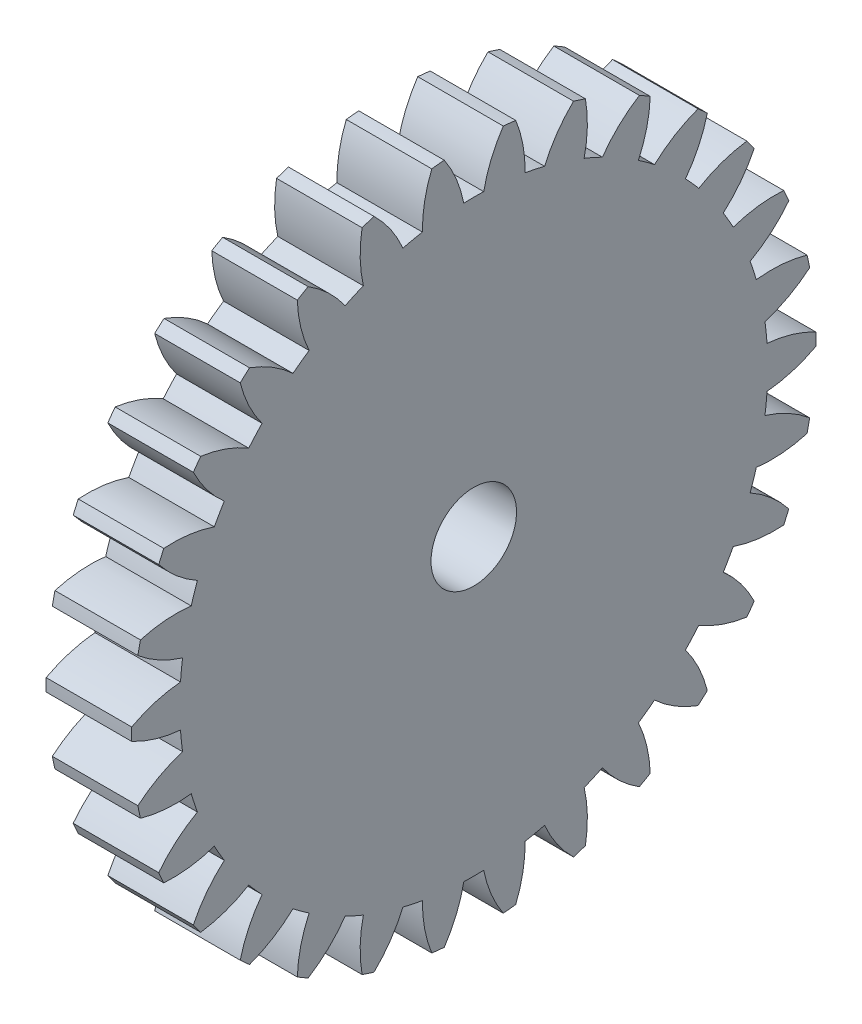
from build123d import *

# Parameters (mm, degrees)
BASPROSKE_W     = 4
BASPROSKE_H     = 16
TOOTHCUT_DEPTH  = 23.978250586
TEETHCUTS_COUNT = 30
TEETHCUTS_ANGLE = 348
BORSKE_R        = 2
BORE_DEPTH      = 50.0000508


with BuildPart() as part:
    # BasProSke → Base-Revolve (revolve)
    with BuildSketch(Plane(origin=(0, 0, 0), x_dir=(1, 0, 0), z_dir=(0, 1, 0)), mode=Mode.PRIVATE) as base_revolve_sk:
        with Locations((2, 8)):
            Rectangle(BASPROSKE_W, BASPROSKE_H)
    revolve(base_revolve_sk.sketch.rotate(Axis((-10, 0, 0), (1, 0, 0)), 180), axis=Axis((-10, 0, 0), (1, 0, 0)))

    # TooCutSke → ToothCut (cut, through all)
    with BuildSketch(Plane(origin=(0, 0, 0), x_dir=(0, 0, -1), z_dir=(1, 0, 0))):
        with BuildLine():
            ThreePointArc((0.466400716, 13.741086979), (0, 13.749), (-0.466400716, 13.741086979))
            ThreePointArc((-0.466400716, 13.741086979), (-0.819142092, 14.899954875), (-1.3974676, 15.964351834))
            ThreePointArc((-1.3974676, 15.964351834), (0, 16.0254), (1.3974676, 15.964351834))
            ThreePointArc((1.3974676, 15.964351834), (0.819142092, 14.899954875), (0.466400716, 13.741086979))
        make_face()
    toothcut = extrude(amount=TOOTHCUT_DEPTH, mode=Mode.SUBTRACT)

    # TeethCuts: ToothCut ×30 about axis
    teethcuts_axis = Axis((-10, 0, 0), (1, 0, 0))
    for i in range(1, TEETHCUTS_COUNT):
        add(toothcut.rotate(teethcuts_axis, i * TEETHCUTS_ANGLE / (TEETHCUTS_COUNT - 1)), mode=Mode.SUBTRACT)

    # BorSke → Bore (cut, symmetric)
    with BuildSketch(Plane(origin=(0, 0, 0), x_dir=(0, 0, -1), z_dir=(1, 0, 0))):
        with Locations(Location((0, 0, 0), (0, 0, 180))):
            Circle(BORSKE_R)
    extrude(amount=BORE_DEPTH, both=True, mode=Mode.SUBTRACT)


solid = part.part
